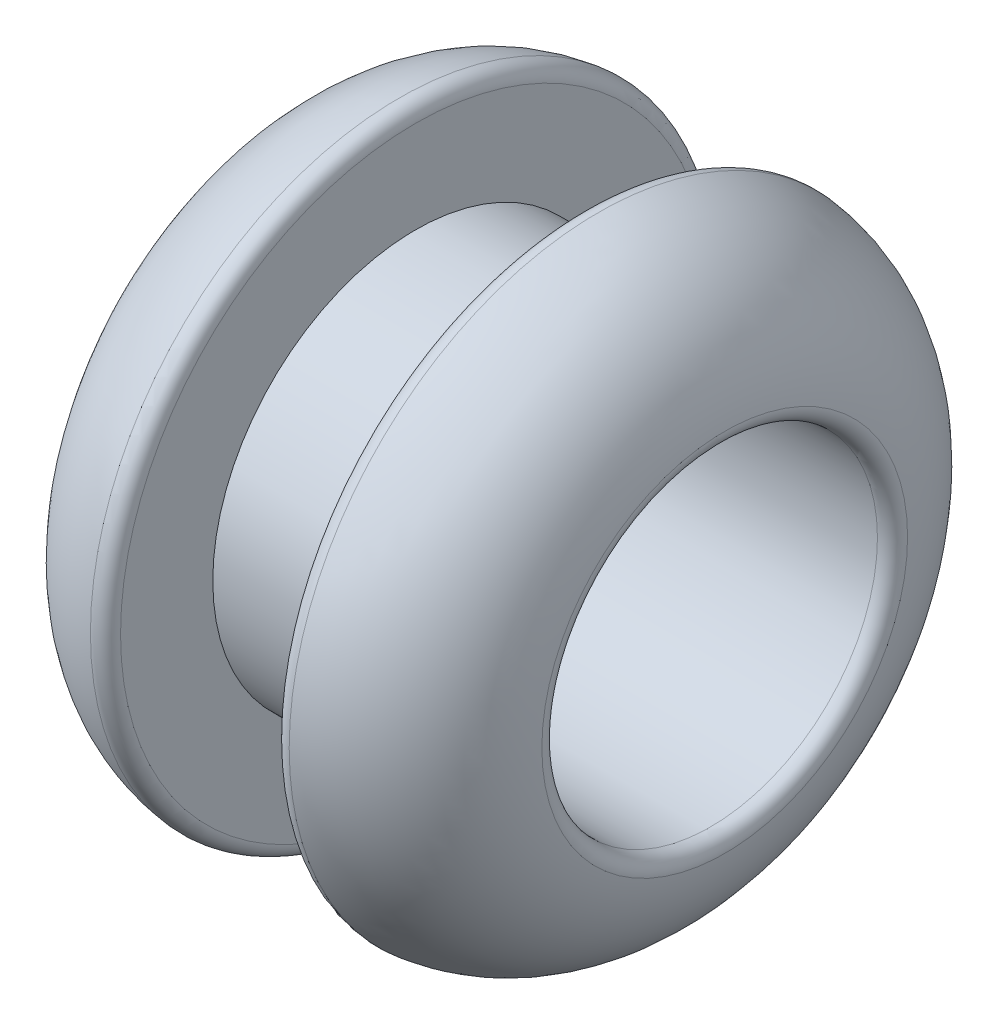
from build123d import *

# Parameters (mm, degrees)
FILLET1_R = 0.15


with BuildPart() as part:
    # Sketch2 → Revolve1 (revolve)
    with BuildSketch(Plane(origin=(0, 0, 0), x_dir=(1, 0, 0), z_dir=(0, 1, 0)), mode=Mode.PRIVATE) as revolve1_sk:
        with BuildLine():
            Line((0, 0), (-4.75, 0))
            ThreePointArc((-4.75, 0), (-4.310660172, 1.060660172), (-3.25, 1.5))
            Line((-3.25, 1.5), (-3.25, 0.375))
            Line((-3.25, 0.375), (-1.5, 0.375))
            Line((-1.5, 0.375), (-1.5, 1.5))
            ThreePointArc((-1.5, 1.5), (-0.439339828, 1.060660172), (0, 0))
        make_face()
    revolve(revolve1_sk.sketch.rotate(Axis((-6.635988873, 0, 1.75), (1, 0, 0)), 180), axis=Axis((-6.635988873, 0, 1.75), (1, 0, 0)))

    # Fillet1
    fillet1_edges = [part.edges().sort_by_distance(p)[0] for p in [
        (-4.75, 0, 0),
        (-3.25, 0, -1.5),
        (-1.5, 0, -1.5),
        (0, 0, 0),
    ]]
    fillet(fillet1_edges, radius=FILLET1_R)


solid = part.part
